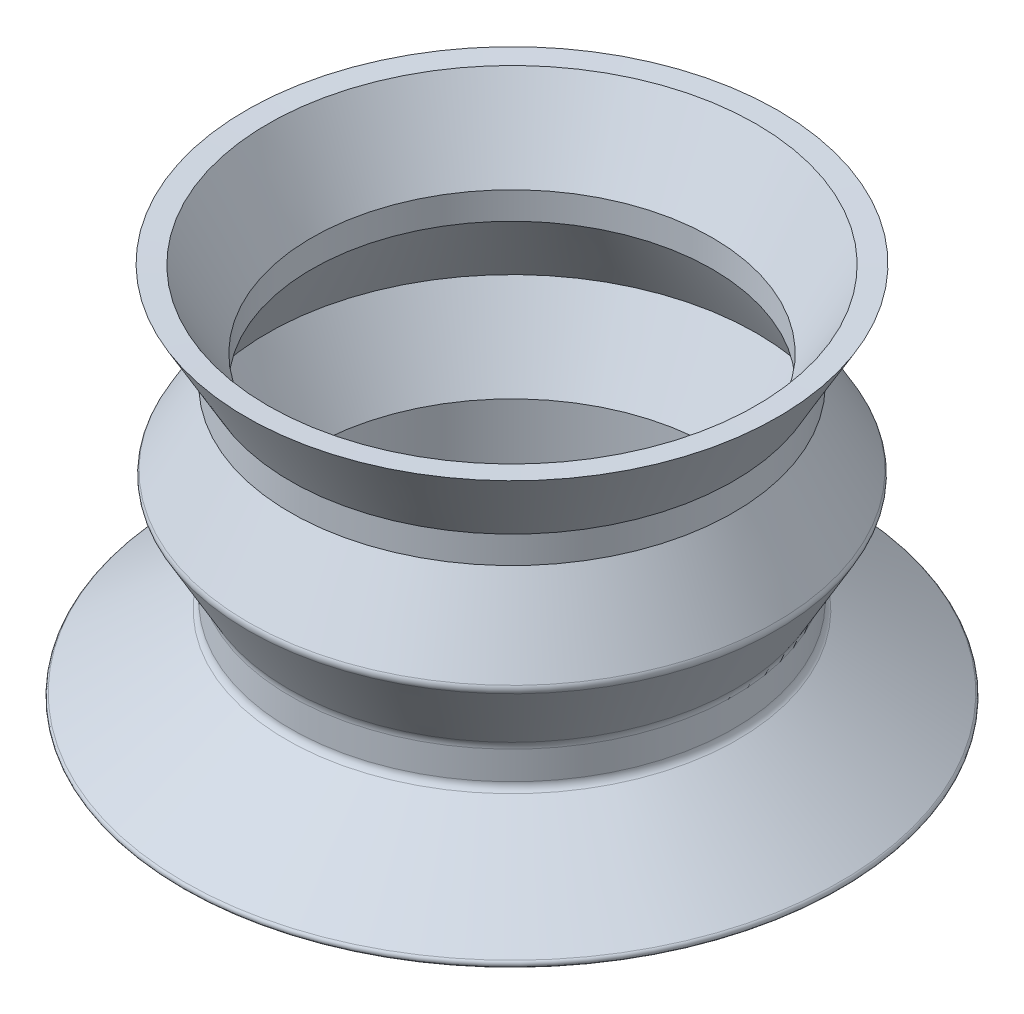
from build123d import *

# Parameters (mm, degrees)
FILLET_OUT_LOW_R    = 0.2
FILLET_ACTIVE_LOW_R = 0.5
FILLET5_R           = 0.4
FILLET6_R           = 0.8


with BuildPart() as part:
    # Sketch1 → Revolve1 (revolve)
    with BuildSketch(Plane.XY, mode=Mode.PRIVATE) as revolve1_sk:
        Polygon((-18, 0), (-12, 4.2), (-12, 6.2), (-14.4, 10.4), (-12, 14.6), (-12, 16.07594668), (-14.4, 20.27594668), (-13.221046964, 20.228343303), (-10.848248893, 16.07594668), (-10.848248893, 14.6), (-13.248248893, 10.4), (-10.875450822, 6.247603376), (-10.875450822, 3.2), (-11.684777769, 3.2), (-16.256206341, 0), (-11.439277272, -3.371850348), (-11.754499503, -4.371850348), align=None)
    revolve(revolve1_sk.sketch.rotate(Axis((0, -8.65, 0), (0, 1, 0)), 270), axis=Axis((0, -8.65, 0), (0, 1, 0)))

    # fillet_out_low
    fillet_out_low_edges = [part.edges().sort_by_distance(p)[0] for p in [
        (0, 0, 18),
    ]]
    fillet(fillet_out_low_edges, radius=FILLET_OUT_LOW_R)

    # Fillet_active_low
    fillet_active_low_edges = [part.edges().sort_by_distance(p)[0] for p in [
        (0, 4.2, 12),
    ]]
    fillet(fillet_active_low_edges, radius=FILLET_ACTIVE_LOW_R)

    # Fillet5
    fillet5_edges = [part.edges().sort_by_distance(p)[0] for p in [
        (0, 10.4, 14.4),
    ]]
    fillet(fillet5_edges, radius=FILLET5_R)

    # Fillet6
    fillet6_edges = [part.edges().sort_by_distance(p)[0] for p in [
        (0, 6.2, 12),
    ]]
    fillet(fillet6_edges, radius=FILLET6_R)


solid = part.part
